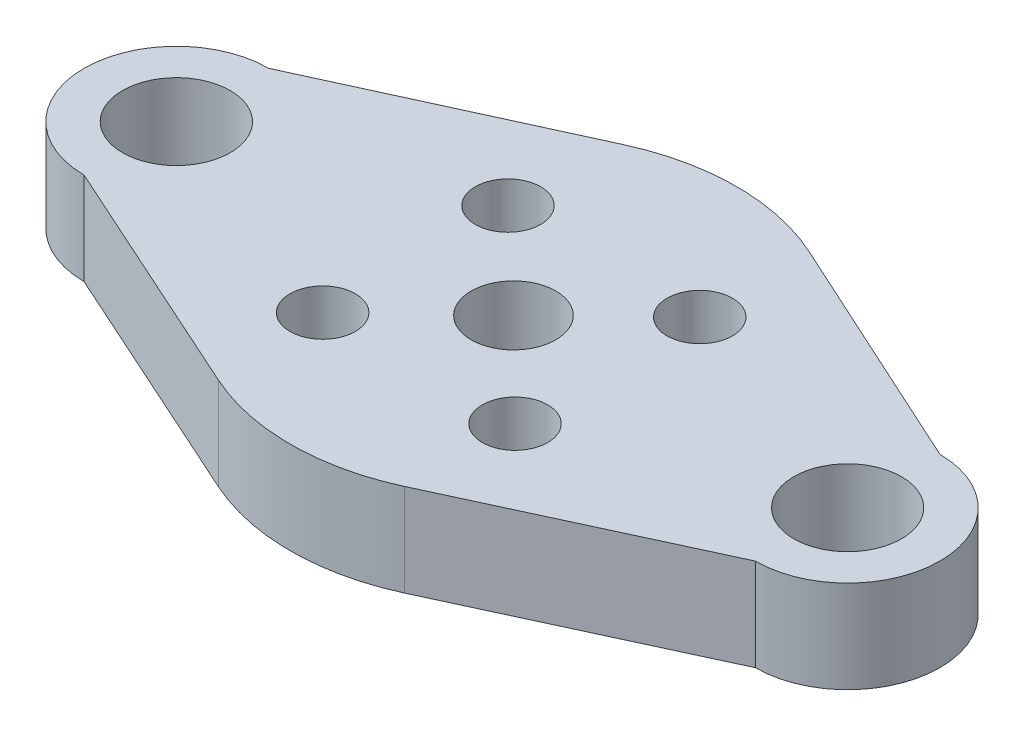
from build123d import *

# Parameters (mm, degrees)
ESBO_O2_R                = 4.25
ESBO_O2_R_2              = 5.5
ESBO_O2_R_3              = 7
RESSALTO_EXTRUS_O2_DEPTH = 12


with BuildPart() as part:
    # Esboço2 → Ressalto-extrusão2 (new body)
    with BuildSketch(Plane(origin=(0, 0, 0), x_dir=(1, 0, 0), z_dir=(0, 1, 0))):
        with BuildLine():
            Line((-12.057610331, 26.374495883), (-43.708926586, 11.904485175))
            ThreePointArc((-43.708926586, 11.904485175), (-55.708926586, -0.095514825), (-43.708926586, -12.095514825))
            Line((-43.708926586, -12.095514825), (-11.925771547, -26.434371054))
            ThreePointArc((-11.925771547, -26.434371054), (0.12376622, -28.999735894), (12.150968312, -26.331615391))
            Line((12.150968312, -26.331615391), (43.35338336, -11.93297137))
            ThreePointArc((43.35338336, -11.93297137), (55.35338336, 0.06702863), (43.35338336, 12.06702863))
            Line((43.35338336, 12.06702863), (12.057610331, 26.374495883))
            ThreePointArc((12.057610331, 26.374495883), (0, 29), (-12.057610331, 26.374495883))
        make_face()
        with Locations(Location((-12.714926554, -12.082390656, 0), (0, 0, 90))):
            Circle(ESBO_O2_R, mode=Mode.SUBTRACT)
        with Locations(Location((12.285073446, -12.082390656, 0), (0, 0, 90))):
            Circle(ESBO_O2_R, mode=Mode.SUBTRACT)
        with Locations(Location((0, 0, 0), (0, 0, 90))):
            Circle(ESBO_O2_R_2, mode=Mode.SUBTRACT)
        with Locations(Location((-12.714788426, 12.000714001, 0), (0, 0, 90))):
            Circle(ESBO_O2_R, mode=Mode.SUBTRACT)
        with Locations(Location((12.285073446, 11.917609344, 0), (0, 0, 90))):
            Circle(ESBO_O2_R, mode=Mode.SUBTRACT)
        with Locations(Location((-43.708926586, -0.095514825, 0), (0, 0, 90))):
            Circle(ESBO_O2_R_3, mode=Mode.SUBTRACT)
        with Locations(Location((43.35338336, 0.06702863, 0), (0, 0, 90))):
            Circle(ESBO_O2_R_3, mode=Mode.SUBTRACT)
    extrude(amount=RESSALTO_EXTRUS_O2_DEPTH)


solid = part.part
